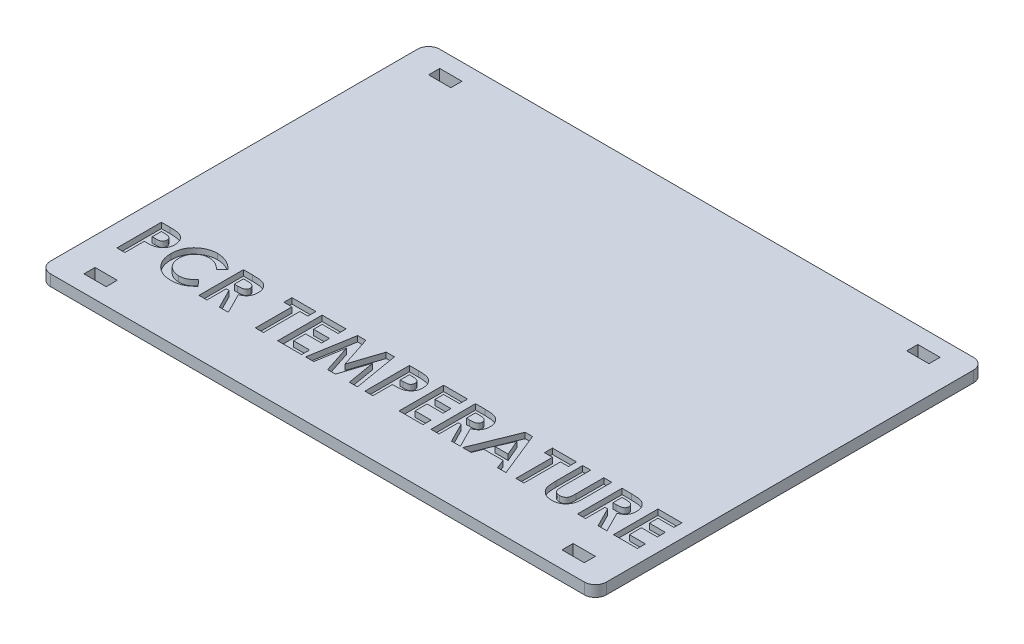
from build123d import *

# Parameters (mm, degrees)
BOSS_EXTRUDE1_DEPTH = 2
SKETCH4_W           = 92
SKETCH4_H           = 62
BOSS_EXTRUDE2_DEPTH = 2
SKETCH5_W           = 4
SKETCH5_H           = 2
CUT_EXTRUDE1_DEPTH  = 62.163714733
CUT_EXTRUDE2_DEPTH  = 1


with BuildPart() as part:
    # Sketch1 → Boss-Extrude1 (new body)
    with BuildSketch(Plane(origin=(0, 0, 0), x_dir=(1, 0, 0), z_dir=(0, 1, 0))):
        with BuildLine():
            Line((-48, 35), (48, 35))
            ThreePointArc((48, 35), (49.414213562, 34.414213562), (50, 33))
            Line((50, 33), (50, -33))
            ThreePointArc((50, -33), (49.414213562, -34.414213562), (48, -35))
            Line((48, -35), (-48, -35))
            ThreePointArc((-48, -35), (-49.414213562, -34.414213562), (-50, -33))
            Line((-50, -33), (-50, 33))
            ThreePointArc((-50, 33), (-49.414213562, 34.414213562), (-48, 35))
        make_face()
    extrude(amount=BOSS_EXTRUDE1_DEPTH)

    # Sketch4 → Boss-Extrude2 (add)
    with BuildSketch(Plane(origin=(0, 0, 0), x_dir=(-1, 0, 0), z_dir=(0, -1, 0))):
        with BuildLine():
            Line((46, 33), (-46, 33))
            ThreePointArc((-46, 33), (-47.414213562, 32.414213562), (-48, 31))
            Line((-48, 31), (-48, -31))
            ThreePointArc((-48, -31), (-47.414213562, -32.414213562), (-46, -33))
            Line((-46, -33), (46, -33))
            ThreePointArc((46, -33), (47.414213562, -32.414213562), (48, -31))
            Line((48, -31), (48, 31))
            ThreePointArc((48, 31), (47.414213562, 32.414213562), (46, 33))
        make_face()
        Rectangle(SKETCH4_W, SKETCH4_H, mode=Mode.SUBTRACT)
    extrude(amount=BOSS_EXTRUDE2_DEPTH)

    # Sketch5 → Cut-Extrude1 (cut, through all)
    with BuildSketch(Plane(origin=(0, 2, 0), x_dir=(1, 0, 0), z_dir=(0, 1, 0))):
        with Locations((-43, 31)):
            Rectangle(SKETCH5_W, SKETCH5_H)
        with Locations((43, 31)):
            Rectangle(SKETCH5_W, SKETCH5_H)
        with Locations((43, -31)):
            Rectangle(SKETCH5_W, SKETCH5_H)
        with Locations((-43, -31)):
            Rectangle(SKETCH5_W, SKETCH5_H)
    extrude(amount=-CUT_EXTRUDE1_DEPTH, mode=Mode.SUBTRACT)

    # Sketch6 → Cut-Extrude2 (cut)
    # profile 1 of 14: a face of its own
    with BuildSketch(Plane(origin=(0, 2, 0), x_dir=(1, 0, 0), z_dir=(0, 1, 0))):
        with BuildLine():
            Line((-46.076923077, -17), (-44.474358974, -17))
            add(Edge.make_bspline(
                [(-44.474358974, -17), (-44.369649515, -17.000468702), (-44.167643019, -17.001372926), (-43.876333032, -17.012337846), (-43.607585306, -17.031987649), (-43.361461585, -17.0562717), (-43.138063069, -17.090316993), (-42.937109996, -17.129347256), (-42.758560663, -17.176897476), (-42.600401662, -17.233338929), (-42.458459067, -17.299881196), (-42.324135592, -17.37075346), (-42.200466961, -17.455337008), (-42.081211246, -17.544515784), (-41.973186501, -17.646809002), (-41.869653496, -17.7554089), (-41.774997136, -17.874622461), (-41.688778819, -18.003006636), (-41.61056552, -18.138189435), (-41.54223315, -18.280412526), (-41.486805758, -18.42990096), (-41.440309068, -18.585687718), (-41.402962474, -18.74776601), (-41.378103392, -18.917132632), (-41.361217853, -19.092605002), (-41.359727937, -19.212031608), (-41.358974359, -19.272435897)],
                knots=[0, 0, 0, 0, 1.698747864, 3.27724071, 4.728299578, 6.070144658, 7.288476769, 8.393259625, 9.389771311, 10.283485332, 11.113357557, 11.931608583, 12.74405601, 13.541433047, 14.344816069, 15.154114104, 15.974336324, 16.810834471, 17.661136416, 18.50621059, 19.367396281, 20.244825668, 21.142564693, 22.063065223, 23.020325768, 24, 24, 24, 24], degree=3))
            add(Edge.make_bspline(
                [(-41.358974359, -19.272435897), (-41.360064692, -19.339259724), (-41.362207332, -19.470576756), (-41.3832121, -19.663071413), (-41.419094882, -19.846597641), (-41.4659918, -20.022703149), (-41.531386217, -20.18849061), (-41.606096269, -20.347915765), (-41.698013329, -20.496508821), (-41.803043264, -20.636128499), (-41.917747936, -20.767909972), (-42.044850429, -20.888048301), (-42.181928113, -20.997362462), (-42.328187497, -21.096998079), (-42.48417768, -21.186754162), (-42.649786109, -21.267471184), (-42.826143652, -21.336567562), (-42.948953738, -21.372704408), (-43.011217949, -21.391025641)],
                knots=[0, 0, 0, 0, 1.102006807, 2.165578795, 3.188629044, 4.184801286, 5.166646146, 6.124351954, 7.085497154, 8.042432466, 9.003981491, 9.963833307, 10.922997304, 11.89326795, 12.880200226, 13.889073926, 14.929769137, 16, 16, 16, 16], degree=3))
            add(Edge.make_bspline(
                [(-43.011217949, -21.391025641), (-43.052228739, -21.401229192), (-43.141071318, -21.42333337), (-43.288081384, -21.445774658), (-43.45749505, -21.466408042), (-43.649860141, -21.484139938), (-43.865287559, -21.496193496), (-44.103568716, -21.505606788), (-44.364811596, -21.512451224), (-44.546469564, -21.512694095), (-44.641025641, -21.512820513)],
                knots=[0, 0, 0, 0, 0.618981996, 1.340914327, 2.176866532, 3.120127938, 4.170906482, 5.338178032, 6.614476169, 8, 8, 8, 8], degree=3))
            Line((-44.641025641, -21.512820513), (-44.641025641, -25))
            Line((-44.641025641, -25), (-46.076923077, -25))
            Line((-46.076923077, -25), (-46.076923077, -17))
        make_face()
        with BuildLine():
            Line((-44.641025641, -20.076923077), (-44.133012821, -20.076923077))
            add(Edge.make_bspline(
                [(-44.133012821, -20.076923077), (-44.040571867, -20.07633693), (-43.870479141, -20.07525841), (-43.638192541, -20.059662385), (-43.451522561, -20.035844105), (-43.304049811, -20.001683183), (-43.187606106, -19.94983946), (-43.087180701, -19.889866036), (-43.001043267, -19.814031287), (-42.926460928, -19.727377111), (-42.866834595, -19.62780712), (-42.825486839, -19.516942617), (-42.79862815, -19.397112984), (-42.7961475, -19.313719492), (-42.794871795, -19.270833333)],
                knots=[0, 0, 0, 0, 1.8619151, 3.425951444, 4.686033666, 5.651700536, 6.461346321, 7.243864085, 7.999046032, 8.762387399, 9.539336099, 10.322741239, 11.137448474, 12, 12, 12, 12], degree=3))
            add(Edge.make_bspline(
                [(-42.794871795, -19.270833333), (-42.796134378, -19.233364255), (-42.798584092, -19.160665236), (-42.816580362, -19.055742518), (-42.845261239, -18.9579329), (-42.886818728, -18.868257874), (-42.940542721, -18.786869813), (-43.00604314, -18.713800778), (-43.082479486, -18.647485934), (-43.141492814, -18.612384474), (-43.171474359, -18.594551282)],
                knots=[0, 0, 0, 0, 1.102301479, 2.1387299, 3.123554645, 4.094223062, 5.036071848, 5.982632524, 6.975082478, 8, 8, 8, 8], degree=3))
            add(Edge.make_bspline(
                [(-43.171474359, -18.594551282), (-43.196870458, -18.581707746), (-43.250639205, -18.554515349), (-43.342212594, -18.5229022), (-43.447886886, -18.496233025), (-43.568375502, -18.474097868), (-43.703197778, -18.456918687), (-43.85232966, -18.443780912), (-44.01599061, -18.4384977), (-44.129807007, -18.436788097), (-44.189102564, -18.435897436)],
                knots=[0, 0, 0, 0, 0.656809284, 1.390599849, 2.23162475, 3.173112763, 4.218524733, 5.370385145, 6.63003504, 8, 8, 8, 8], degree=3))
            Line((-44.189102564, -18.435897436), (-44.641025641, -18.435897436))
            Line((-44.641025641, -18.435897436), (-44.641025641, -20.076923077))
        make_face(mode=Mode.SUBTRACT)
    # profile 2 of 14: a face of its own
    with BuildSketch(Plane(origin=(0, 2, 0), x_dir=(1, 0, 0), z_dir=(0, 1, 0))):
        with BuildLine():
            Line((-32.743589744, -18.387820513), (-33.796474359, -19.394230769))
            add(Edge.make_bspline(
                [(-33.796474359, -19.394230769), (-33.88578861, -19.301879684), (-34.060247323, -19.121489083), (-34.341365963, -18.882667824), (-34.633719112, -18.683642618), (-34.931619625, -18.516024857), (-35.240425868, -18.389210074), (-35.556567199, -18.296798006), (-35.882062274, -18.240457861), (-36.102344821, -18.234011551), (-36.213141026, -18.230769231)],
                knots=[0, 0, 0, 0, 1.115251505, 2.178435587, 3.19620269, 4.182487026, 5.141301733, 6.088180966, 7.038406374, 8, 8, 8, 8], degree=3))
            add(Edge.make_bspline(
                [(-36.213141026, -18.230769231), (-36.305669321, -18.233330777), (-36.488263717, -18.238385707), (-36.75636014, -18.275443331), (-37.012808224, -18.338461432), (-37.258485831, -18.425312048), (-37.492670045, -18.537692136), (-37.715851862, -18.675514717), (-37.927481037, -18.837535056), (-38.12476207, -19.022914853), (-38.305227826, -19.225456212), (-38.464680812, -19.441567358), (-38.598248266, -19.670753194), (-38.707864902, -19.910692693), (-38.793252025, -20.162496415), (-38.854229158, -20.425994835), (-38.889496702, -20.70150176), (-38.89476062, -20.888789314), (-38.897435897, -20.983974359)],
                knots=[0, 0, 0, 0, 1.035432265, 2.043311493, 3.022114605, 3.98653278, 4.95457646, 5.923598177, 6.917315552, 7.932509744, 8.948865224, 9.949768934, 10.933144597, 11.912367597, 12.897413939, 13.903909035, 14.934704909, 16, 16, 16, 16], degree=3))
            add(Edge.make_bspline(
                [(-38.897435897, -20.983974359), (-38.896664913, -21.050781883), (-38.895145287, -21.182460886), (-38.878510289, -21.377250678), (-38.851724021, -21.566242826), (-38.812957655, -21.749151058), (-38.764479932, -21.926133885), (-38.707604526, -22.098718127), (-38.636255164, -22.264519059), (-38.557056297, -22.425462351), (-38.464948927, -22.577156464), (-38.365640191, -22.721809391), (-38.25795608, -22.858712057), (-38.141199118, -22.987304799), (-38.013726097, -23.105578002), (-37.878831722, -23.21708828), (-37.734240512, -23.319044155), (-37.582955992, -23.414004321), (-37.423671256, -23.496497025), (-37.260708068, -23.571219477), (-37.091595577, -23.631905219), (-36.91839283, -23.680823462), (-36.741718792, -23.722421123), (-36.559845427, -23.74803408), (-36.374349349, -23.767430474), (-36.248985136, -23.768628088), (-36.185897436, -23.769230769)],
                knots=[0, 0, 0, 0, 1.103660481, 2.175337485, 3.227646561, 4.255952547, 5.262355991, 6.258840057, 7.255597736, 8.242457506, 9.22035537, 10.185017736, 11.140346927, 12.096287581, 13.051739095, 14.01125915, 14.986044842, 15.97314143, 16.960198552, 17.947847494, 18.933482797, 19.925264591, 20.920966487, 21.929612487, 22.958107872, 24, 24, 24, 24], degree=3))
            add(Edge.make_bspline(
                [(-36.185897436, -23.769230769), (-36.078889854, -23.766135542), (-35.868647783, -23.760054226), (-35.560087313, -23.712499193), (-35.266059925, -23.634273854), (-35.031133449, -23.541894275), (-34.84707476, -23.450668241), (-34.706953601, -23.366288652), (-34.562057402, -23.271900817), (-34.414792765, -23.163942438), (-34.263503254, -23.043709057), (-34.110859478, -22.908567341), (-33.95295373, -22.762967311), (-33.849511239, -22.659049709), (-33.796474359, -22.605769231)],
                knots=[0, 0, 0, 0, 1.404581149, 2.759636711, 4.088442092, 5.392261763, 6.066678138, 6.783632037, 7.538459478, 8.336747902, 9.180226004, 10.074962426, 11.012997595, 12, 12, 12, 12], degree=3))
            Line((-33.796474359, -22.605769231), (-32.775641026, -23.677884615))
            add(Edge.make_bspline(
                [(-32.775641026, -23.677884615), (-32.847400114, -23.747165763), (-32.987458509, -23.882387746), (-33.198732709, -24.074390344), (-33.409741013, -24.246926022), (-33.615385898, -24.40625707), (-33.819036044, -24.547741786), (-34.020669852, -24.671521474), (-34.21800474, -24.780726701), (-34.415138431, -24.873515774), (-34.613297591, -24.952303334), (-34.817180081, -25.020134252), (-35.027409187, -25.077516768), (-35.245268893, -25.123816923), (-35.468727137, -25.160943396), (-35.699875191, -25.186003551), (-35.937247461, -25.202850659), (-36.09826075, -25.204364512), (-36.179487179, -25.205128205)],
                knots=[0, 0, 0, 0, 1.244526981, 2.429050516, 3.560637417, 4.644440555, 5.67424972, 6.652764056, 7.595344123, 8.486817594, 9.369275933, 10.254498637, 11.166417451, 12.086725134, 13.032340136, 13.991389299, 14.986715468, 16, 16, 16, 16], degree=3))
            add(Edge.make_bspline(
                [(-36.179487179, -25.205128205), (-36.328690069, -25.201324726), (-36.620638649, -25.193882374), (-37.048481681, -25.138739588), (-37.454921077, -25.046293679), (-37.840945628, -24.915549665), (-38.206432586, -24.748530314), (-38.55128845, -24.543772432), (-38.874957387, -24.301820029), (-39.174824791, -24.025509022), (-39.446069128, -23.720346711), (-39.685817711, -23.392686107), (-39.884137748, -23.040916878), (-40.048807148, -22.67023578), (-40.177576453, -22.278951251), (-40.268208214, -21.86664004), (-40.32410016, -21.433700259), (-40.330214818, -21.137992409), (-40.333333333, -20.987179487)],
                knots=[0, 0, 0, 0, 1.078019885, 2.10938526, 3.111377082, 4.085535484, 5.04941344, 6.010039228, 6.978205633, 7.964457913, 8.951525778, 9.924444315, 10.892603023, 11.863865945, 12.85144698, 13.863884204, 14.910567087, 16, 16, 16, 16], degree=3))
            add(Edge.make_bspline(
                [(-40.333333333, -20.987179487), (-40.3320156, -20.888820586), (-40.329404174, -20.693897284), (-40.301957849, -20.406759468), (-40.263696075, -20.126851458), (-40.202997251, -19.857079628), (-40.129830804, -19.593809653), (-40.038838715, -19.33990297), (-39.93016631, -19.094629825), (-39.807316357, -18.857579618), (-39.668337435, -18.63030528), (-39.513082721, -18.414759457), (-39.345549078, -18.209278175), (-39.161710945, -18.016587523), (-38.964239731, -17.834995641), (-38.752243877, -17.66548661), (-38.526998431, -17.505629479), (-38.287893738, -17.359546576), (-38.039574965, -17.227406825), (-37.785174065, -17.110853921), (-37.525316071, -17.013442534), (-37.261099687, -16.932643381), (-36.991408602, -16.872332527), (-36.718167802, -16.826679156), (-36.439052336, -16.80115863), (-36.251650481, -16.796980757), (-36.157051282, -16.794871795)],
                knots=[0, 0, 0, 0, 1.071919942, 2.124283339, 3.142214191, 4.149696895, 5.136002878, 6.119640489, 7.086990633, 8.058538607, 9.028339693, 9.988281803, 10.952401235, 11.916291999, 12.888973767, 13.874849856, 14.873389453, 15.898127285, 16.927174885, 17.938320013, 18.946391617, 19.950418109, 20.947802303, 21.956882652, 22.968648068, 24, 24, 24, 24], degree=3))
            add(Edge.make_bspline(
                [(-36.157051282, -16.794871795), (-36.076348466, -16.796080705), (-35.915781917, -16.798485955), (-35.676671382, -16.818536333), (-35.439473142, -16.850025249), (-35.205036438, -16.897535318), (-34.971684339, -16.953935774), (-34.742483354, -17.02778439), (-34.513817714, -17.11010259), (-34.289273698, -17.20849719), (-34.068537878, -17.315903784), (-33.856781336, -17.437760465), (-33.650448701, -17.566568309), (-33.454112179, -17.709950729), (-33.264093964, -17.862706978), (-33.081387679, -18.02554975), (-32.907596679, -18.201194111), (-32.798535096, -18.325297221), (-32.743589744, -18.387820513)],
                knots=[0, 0, 0, 0, 0.996412454, 1.982464992, 2.961075852, 3.949442424, 4.934965278, 5.923860011, 6.921385422, 7.934793307, 8.949617135, 9.951082467, 10.950285876, 11.951772932, 12.951063433, 13.960125323, 14.972308753, 16, 16, 16, 16], degree=3))
        make_face()
    # profile 3 of 14: a face of its own
    with BuildSketch(Plane(origin=(0, 2, 0), x_dir=(1, 0, 0), z_dir=(0, 1, 0))):
        with BuildLine():
            Line((-31.307692308, -17), (-29.634615385, -17))
            add(Edge.make_bspline(
                [(-29.634615385, -17), (-29.524025509, -17.000392531), (-29.311330027, -17.001147477), (-29.00463476, -17.01305854), (-28.722892979, -17.02963376), (-28.465687541, -17.054927987), (-28.233128483, -17.088465074), (-28.024982725, -17.12799975), (-27.841256351, -17.173057989), (-27.680399885, -17.229204111), (-27.535234878, -17.292536084), (-27.39992091, -17.365305683), (-27.271472753, -17.446702594), (-27.150748944, -17.538868592), (-27.036700366, -17.640145632), (-26.929111858, -17.750635659), (-26.829503747, -17.871275584), (-26.738492809, -18.001303116), (-26.655543665, -18.138089097), (-26.582234019, -18.281821336), (-26.522618493, -18.432599789), (-26.469941786, -18.588245382), (-26.43200046, -18.750983099), (-26.405612823, -18.91922866), (-26.386292827, -19.093574309), (-26.385182019, -19.212017001), (-26.384615385, -19.272435897)],
                knots=[0, 0, 0, 0, 1.749336639, 3.364467119, 4.854658419, 6.213483162, 7.451590619, 8.570285859, 9.5643256, 10.440900261, 11.26203566, 12.067320669, 12.869050712, 13.665104639, 14.467235401, 15.27997916, 16.102287765, 16.939272006, 17.78853747, 18.631303466, 19.488103222, 20.351255419, 21.228522269, 22.127379805, 23.044756219, 24, 24, 24, 24], degree=3))
            add(Edge.make_bspline(
                [(-26.384615385, -19.272435897), (-26.386087298, -19.335499346), (-26.388973452, -19.459155274), (-26.404519849, -19.640795747), (-26.432933779, -19.814576646), (-26.475970808, -19.979989163), (-26.525436284, -20.139092048), (-26.591212678, -20.288949755), (-26.66544784, -20.431741746), (-26.753614773, -20.565448174), (-26.850373675, -20.693038928), (-26.962902243, -20.80962553), (-27.083910353, -20.92147407), (-27.220200313, -21.021578735), (-27.365764334, -21.116708241), (-27.52349462, -21.202920907), (-27.692361771, -21.282383921), (-27.81108374, -21.326697987), (-27.871794872, -21.349358974)],
                knots=[0, 0, 0, 0, 1.099860209, 2.156625411, 3.176576793, 4.16617041, 5.135385252, 6.078461593, 7.016046972, 7.938469504, 8.868247731, 9.803980173, 10.76021508, 11.73834243, 12.748633912, 13.790971185, 14.870363756, 16, 16, 16, 16], degree=3))
            Line((-27.871794872, -21.349358974), (-26.025641026, -25))
            Line((-26.025641026, -25), (-27.621794872, -25))
            Line((-27.621794872, -25), (-29.384615385, -21.512820513))
            Line((-29.384615385, -21.512820513), (-29.871794872, -21.512820513))
            Line((-29.871794872, -21.512820513), (-29.871794872, -25))
            Line((-29.871794872, -25), (-31.307692308, -25))
            Line((-31.307692308, -25), (-31.307692308, -17))
        make_face()
        with BuildLine():
            Line((-29.871794872, -20.076923077), (-29.3125, -20.076923077))
            add(Edge.make_bspline(
                [(-29.3125, -20.076923077), (-29.244121553, -20.076152953), (-29.113191519, -20.074678331), (-28.924896934, -20.067838423), (-28.753880545, -20.051357624), (-28.59940795, -20.03053475), (-28.460701856, -20.006491735), (-28.338999474, -19.972036635), (-28.232425555, -19.935117124), (-28.142243005, -19.889235747), (-28.065193105, -19.837058672), (-27.998665449, -19.777784216), (-27.943637538, -19.709181582), (-27.898346761, -19.633115092), (-27.86311546, -19.548911957), (-27.83739931, -19.457496537), (-27.823027785, -19.357827493), (-27.821374292, -19.289042281), (-27.820512821, -19.253205128)],
                knots=[0, 0, 0, 0, 1.688639943, 3.233382647, 4.650958383, 5.928841754, 7.082724185, 8.122798841, 9.049171256, 9.863274652, 10.613301712, 11.341792392, 12.054588806, 12.776240173, 13.521029143, 14.301969904, 15.115324896, 16, 16, 16, 16], degree=3))
            add(Edge.make_bspline(
                [(-27.820512821, -19.253205128), (-27.822141511, -19.21080716), (-27.825340771, -19.127524208), (-27.857087371, -19.00762596), (-27.9076211, -18.896651928), (-27.976889003, -18.79510352), (-28.06412292, -18.706079176), (-28.164230723, -18.627603508), (-28.27937298, -18.565550821), (-28.385986045, -18.52462153), (-28.482979014, -18.500133112), (-28.570512108, -18.48188456), (-28.671875959, -18.468951288), (-28.787147089, -18.45523325), (-28.91603167, -18.446337797), (-29.059232199, -18.439845889), (-29.216337405, -18.437189731), (-29.325854655, -18.436340604), (-29.383012821, -18.435897436)],
                knots=[0, 0, 0, 0, 1.020303359, 2.004196876, 2.966617323, 3.9489082, 4.950758222, 5.960522915, 7.003732012, 8.091992268, 8.70421221, 9.413913587, 10.24622431, 11.166358409, 12.212345909, 13.359657661, 14.621978493, 16, 16, 16, 16], degree=3))
            Line((-29.383012821, -18.435897436), (-29.871794872, -18.435897436))
            Line((-29.871794872, -18.435897436), (-29.871794872, -20.076923077))
        make_face(mode=Mode.SUBTRACT)
    # profile 4 of 14: a face of its own
    with BuildSketch(Plane(origin=(0, 2, 0), x_dir=(1, 0, 0), z_dir=(0, 1, 0))):
        Polygon((-22.58974359, -17), (-18.282051282, -17), (-18.282051282, -18.435897436), (-19.717948718, -18.435897436), (-19.717948718, -25), (-21.153846154, -25), (-21.153846154, -18.435897436), (-22.58974359, -18.435897436), align=None)
    # profile 5 of 14: a face of its own
    with BuildSketch(Plane(origin=(0, 2, 0), x_dir=(1, 0, 0), z_dir=(0, 1, 0))):
        Polygon((-17.153846154, -17), (-12.846153846, -17), (-12.846153846, -18.435897436), (-15.717948718, -18.435897436), (-15.717948718, -19.974358974), (-12.846153846, -19.974358974), (-12.846153846, -21.41025641), (-15.717948718, -21.41025641), (-15.717948718, -23.564102564), (-12.846153846, -23.564102564), (-12.846153846, -25), (-17.153846154, -25), align=None)
    # profile 6 of 14: a face of its own
    with BuildSketch(Plane(origin=(0, 2, 0), x_dir=(1, 0, 0), z_dir=(0, 1, 0))):
        Polygon((-10.77724359, -17), (-9.290064103, -17), (-7.461538462, -22.580128205), (-5.623397436, -17), (-4.147435897, -17), (-2.794871795, -25), (-4.248397436, -25), (-5.102564103, -19.947115385), (-6.766025641, -25), (-8.165064103, -25), (-9.820512821, -19.947115385), (-10.673076923, -25), (-12.128205128, -25), align=None)
    # profile 7 of 14: a face of its own
    with BuildSketch(Plane(origin=(0, 2, 0), x_dir=(1, 0, 0), z_dir=(0, 1, 0))):
        with BuildLine():
            Line((-1.461538462, -17), (0.141025641, -17))
            add(Edge.make_bspline(
                [(0.141025641, -17), (0.245735101, -17.000468702), (0.447741596, -17.001372926), (0.739051583, -17.012337846), (1.007799309, -17.031987649), (1.25392303, -17.0562717), (1.477321546, -17.090316993), (1.678274619, -17.129347256), (1.856823952, -17.176897476), (2.014982953, -17.233338929), (2.156925548, -17.299881196), (2.291249024, -17.37075346), (2.414917654, -17.455337008), (2.53417337, -17.544515784), (2.642198115, -17.646809002), (2.74573112, -17.7554089), (2.840387479, -17.874622461), (2.926605796, -18.003006636), (3.004819095, -18.138189435), (3.073151465, -18.280412526), (3.128578857, -18.42990096), (3.175075547, -18.585687718), (3.212422141, -18.74776601), (3.237281223, -18.917132632), (3.254166762, -19.092605002), (3.255656678, -19.212031608), (3.256410256, -19.272435897)],
                knots=[0, 0, 0, 0, 1.698747864, 3.27724071, 4.728299578, 6.070144658, 7.288476769, 8.393259625, 9.389771311, 10.283485332, 11.113357557, 11.931608583, 12.74405601, 13.541433047, 14.344816069, 15.154114104, 15.974336324, 16.810834471, 17.661136416, 18.50621059, 19.367396281, 20.244825668, 21.142564693, 22.063065223, 23.020325768, 24, 24, 24, 24], degree=3))
            add(Edge.make_bspline(
                [(3.256410256, -19.272435897), (3.255319923, -19.339259724), (3.253177284, -19.470576756), (3.232172515, -19.663071413), (3.196289734, -19.846597641), (3.149392815, -20.022703149), (3.083998398, -20.18849061), (3.009288347, -20.347915765), (2.917371287, -20.496508821), (2.812341351, -20.636128499), (2.697636679, -20.767909972), (2.570534187, -20.888048301), (2.433456502, -20.997362462), (2.287197119, -21.096998079), (2.131206935, -21.186754162), (1.965598507, -21.267471184), (1.789240964, -21.336567562), (1.666430877, -21.372704408), (1.604166667, -21.391025641)],
                knots=[0, 0, 0, 0, 1.102006807, 2.165578795, 3.188629044, 4.184801286, 5.166646146, 6.124351954, 7.085497154, 8.042432466, 9.003981491, 9.963833307, 10.922997304, 11.89326795, 12.880200226, 13.889073926, 14.929769137, 16, 16, 16, 16], degree=3))
            add(Edge.make_bspline(
                [(1.604166667, -21.391025641), (1.563155876, -21.401229192), (1.474313297, -21.42333337), (1.327303231, -21.445774658), (1.157889565, -21.466408042), (0.965524475, -21.484139938), (0.750097056, -21.496193496), (0.511815899, -21.505606788), (0.25057302, -21.512451224), (0.068915052, -21.512694095), (-0.025641026, -21.512820513)],
                knots=[0, 0, 0, 0, 0.618981996, 1.340914327, 2.176866532, 3.120127938, 4.170906482, 5.338178032, 6.614476169, 8, 8, 8, 8], degree=3))
            Line((-0.025641026, -21.512820513), (-0.025641026, -25))
            Line((-0.025641026, -25), (-1.461538462, -25))
            Line((-1.461538462, -25), (-1.461538462, -17))
        make_face()
        with BuildLine():
            Line((-0.025641026, -20.076923077), (0.482371795, -20.076923077))
            add(Edge.make_bspline(
                [(0.482371795, -20.076923077), (0.574812748, -20.07633693), (0.744905475, -20.07525841), (0.977192075, -20.059662385), (1.163862054, -20.035844105), (1.311334805, -20.001683183), (1.427778509, -19.94983946), (1.528203914, -19.889866036), (1.614341348, -19.814031287), (1.688923688, -19.727377111), (1.74855002, -19.62780712), (1.789897776, -19.516942617), (1.816756466, -19.397112984), (1.819237115, -19.313719492), (1.820512821, -19.270833333)],
                knots=[0, 0, 0, 0, 1.8619151, 3.425951444, 4.686033666, 5.651700536, 6.461346321, 7.243864085, 7.999046032, 8.762387399, 9.539336099, 10.322741239, 11.137448474, 12, 12, 12, 12], degree=3))
            add(Edge.make_bspline(
                [(1.820512821, -19.270833333), (1.819250238, -19.233364255), (1.816800523, -19.160665236), (1.798804253, -19.055742518), (1.770123376, -18.9579329), (1.728565887, -18.868257874), (1.674841895, -18.786869813), (1.609341476, -18.713800778), (1.53290513, -18.647485934), (1.473891802, -18.612384474), (1.443910256, -18.594551282)],
                knots=[0, 0, 0, 0, 1.102301479, 2.1387299, 3.123554645, 4.094223062, 5.036071848, 5.982632524, 6.975082478, 8, 8, 8, 8], degree=3))
            add(Edge.make_bspline(
                [(1.443910256, -18.594551282), (1.418514157, -18.581707746), (1.36474541, -18.554515349), (1.273172022, -18.5229022), (1.16749773, -18.496233025), (1.047009114, -18.474097868), (0.912186838, -18.456918687), (0.763054955, -18.443780912), (0.599394006, -18.4384977), (0.485577608, -18.436788097), (0.426282051, -18.435897436)],
                knots=[0, 0, 0, 0, 0.656809284, 1.390599849, 2.23162475, 3.173112763, 4.218524733, 5.370385145, 6.63003504, 8, 8, 8, 8], degree=3))
            Line((0.426282051, -18.435897436), (-0.025641026, -18.435897436))
            Line((-0.025641026, -18.435897436), (-0.025641026, -20.076923077))
        make_face(mode=Mode.SUBTRACT)
    # profile 8 of 14: a face of its own
    with BuildSketch(Plane(origin=(0, 2, 0), x_dir=(1, 0, 0), z_dir=(0, 1, 0))):
        Polygon((4.692307692, -17), (9, -17), (9, -18.435897436), (6.128205128, -18.435897436), (6.128205128, -19.974358974), (9, -19.974358974), (9, -21.41025641), (6.128205128, -21.41025641), (6.128205128, -23.564102564), (9, -23.564102564), (9, -25), (4.692307692, -25), align=None)
    # profile 9 of 14: a face of its own
    with BuildSketch(Plane(origin=(0, 2, 0), x_dir=(1, 0, 0), z_dir=(0, 1, 0))):
        with BuildLine():
            Line((10.435897436, -17), (12.108974359, -17))
            add(Edge.make_bspline(
                [(12.108974359, -17), (12.219564234, -17.000392531), (12.432259716, -17.001147477), (12.738954984, -17.01305854), (13.020696764, -17.02963376), (13.277902202, -17.054927987), (13.510461261, -17.088465074), (13.718607019, -17.12799975), (13.902333392, -17.173057989), (14.063189859, -17.229204111), (14.208354866, -17.292536084), (14.343668834, -17.365305683), (14.472116991, -17.446702594), (14.5928408, -17.538868592), (14.706889378, -17.640145632), (14.814477885, -17.750635659), (14.914085997, -17.871275584), (15.005096935, -18.001303116), (15.088046078, -18.138089097), (15.161355724, -18.281821336), (15.22097125, -18.432599789), (15.273647958, -18.588245382), (15.311589284, -18.750983099), (15.337976921, -18.91922866), (15.357296917, -19.093574309), (15.358407724, -19.212017001), (15.358974359, -19.272435897)],
                knots=[0, 0, 0, 0, 1.749336639, 3.364467119, 4.854658419, 6.213483162, 7.451590619, 8.570285859, 9.5643256, 10.440900261, 11.26203566, 12.067320669, 12.869050712, 13.665104639, 14.467235401, 15.27997916, 16.102287765, 16.939272006, 17.78853747, 18.631303466, 19.488103222, 20.351255419, 21.228522269, 22.127379805, 23.044756219, 24, 24, 24, 24], degree=3))
            add(Edge.make_bspline(
                [(15.358974359, -19.272435897), (15.357502445, -19.335499346), (15.354616291, -19.459155274), (15.339069895, -19.640795747), (15.310655965, -19.814576646), (15.267618935, -19.979989163), (15.218153459, -20.139092048), (15.152377065, -20.288949755), (15.078141903, -20.431741746), (14.98997497, -20.565448174), (14.893216068, -20.693038928), (14.780687501, -20.80962553), (14.659679391, -20.92147407), (14.523389431, -21.021578735), (14.37782541, -21.116708241), (14.220095123, -21.202920907), (14.051227973, -21.282383921), (13.932506004, -21.326697987), (13.871794872, -21.349358974)],
                knots=[0, 0, 0, 0, 1.099860209, 2.156625411, 3.176576793, 4.16617041, 5.135385252, 6.078461593, 7.016046972, 7.938469504, 8.868247731, 9.803980173, 10.76021508, 11.73834243, 12.748633912, 13.790971185, 14.870363756, 16, 16, 16, 16], degree=3))
            Line((13.871794872, -21.349358974), (15.717948718, -25))
            Line((15.717948718, -25), (14.121794872, -25))
            Line((14.121794872, -25), (12.358974359, -21.512820513))
            Line((12.358974359, -21.512820513), (11.871794872, -21.512820513))
            Line((11.871794872, -21.512820513), (11.871794872, -25))
            Line((11.871794872, -25), (10.435897436, -25))
            Line((10.435897436, -25), (10.435897436, -17))
        make_face()
        with BuildLine():
            Line((11.871794872, -20.076923077), (12.431089744, -20.076923077))
            add(Edge.make_bspline(
                [(12.431089744, -20.076923077), (12.499468191, -20.076152953), (12.630398225, -20.074678331), (12.81869281, -20.067838423), (12.989709199, -20.051357624), (13.144181794, -20.03053475), (13.282887887, -20.006491735), (13.404590269, -19.972036635), (13.511164188, -19.935117124), (13.601346739, -19.889235747), (13.678396638, -19.837058672), (13.744924294, -19.777784216), (13.799952205, -19.709181582), (13.845242983, -19.633115092), (13.880474283, -19.548911957), (13.906190434, -19.457496537), (13.920561959, -19.357827493), (13.922215452, -19.289042281), (13.923076923, -19.253205128)],
                knots=[0, 0, 0, 0, 1.688639943, 3.233382647, 4.650958383, 5.928841754, 7.082724185, 8.122798841, 9.049171256, 9.863274652, 10.613301712, 11.341792392, 12.054588806, 12.776240173, 13.521029143, 14.301969904, 15.115324896, 16, 16, 16, 16], degree=3))
            add(Edge.make_bspline(
                [(13.923076923, -19.253205128), (13.921448233, -19.21080716), (13.918248973, -19.127524208), (13.886502373, -19.00762596), (13.835968643, -18.896651928), (13.766700741, -18.79510352), (13.679466823, -18.706079176), (13.57935902, -18.627603508), (13.464216764, -18.565550821), (13.357603699, -18.52462153), (13.26061073, -18.500133112), (13.173077635, -18.48188456), (13.071713785, -18.468951288), (12.956442654, -18.45523325), (12.827558074, -18.446337797), (12.684357545, -18.439845889), (12.527252339, -18.437189731), (12.417735089, -18.436340604), (12.360576923, -18.435897436)],
                knots=[0, 0, 0, 0, 1.020303359, 2.004196876, 2.966617323, 3.9489082, 4.950758222, 5.960522915, 7.003732012, 8.091992268, 8.70421221, 9.413913587, 10.24622431, 11.166358409, 12.212345909, 13.359657661, 14.621978493, 16, 16, 16, 16], degree=3))
            Line((12.360576923, -18.435897436), (11.871794872, -18.435897436))
            Line((11.871794872, -18.435897436), (11.871794872, -20.076923077))
        make_face(mode=Mode.SUBTRACT)
    # profile 10 of 14: a face of its own
    with BuildSketch(Plane(origin=(0, 2, 0), x_dir=(1, 0, 0), z_dir=(0, 1, 0))):
        Polygon((19.357371795, -17), (20.692307692, -17), (23.923076923, -25), (22.389423077, -25), (21.767628205, -23.358974359), (18.28525641, -23.358974359), (17.661858974, -25), (16.128205128, -25), align=None)
        Polygon((20.025641026, -19.145833333), (18.830128205, -21.923076923), (21.22275641, -21.923076923), align=None, mode=Mode.SUBTRACT)
    # profile 11 of 14: a face of its own
    with BuildSketch(Plane(origin=(0, 2, 0), x_dir=(1, 0, 0), z_dir=(0, 1, 0))):
        Polygon((24.282051282, -17), (28.58974359, -17), (28.58974359, -18.435897436), (27.153846154, -18.435897436), (27.153846154, -25), (25.717948718, -25), (25.717948718, -18.435897436), (24.282051282, -18.435897436), align=None)
    # profile 12 of 14: a face of its own
    with BuildSketch(Plane(origin=(0, 2, 0), x_dir=(1, 0, 0), z_dir=(0, 1, 0))):
        with BuildLine():
            Line((29.717948718, -17), (31.153846154, -17))
            Line((31.153846154, -17), (31.153846154, -22.205128205))
            add(Edge.make_bspline(
                [(31.153846154, -22.205128205), (31.153924231, -22.259092717), (31.154075036, -22.363324613), (31.161624411, -22.512863259), (31.168532609, -22.650320585), (31.18099696, -22.775546103), (31.199411079, -22.888593383), (31.217241954, -22.990188598), (31.241374281, -23.078512802), (31.27764131, -23.179048869), (31.333516896, -23.292006633), (31.424814504, -23.409733805), (31.530164132, -23.517176937), (31.65643173, -23.606608529), (31.798345343, -23.678950627), (31.95512522, -23.732548115), (32.126550356, -23.762341202), (32.245081434, -23.766889663), (32.306089744, -23.769230769)],
                knots=[0, 0, 0, 0, 1.155499968, 2.231836252, 3.205919964, 4.102923608, 4.924856345, 5.658536265, 6.31071849, 6.882491295, 7.94666036, 8.992281882, 10.060072772, 11.158554251, 12.289267114, 13.461410017, 14.693379945, 16, 16, 16, 16], degree=3))
            add(Edge.make_bspline(
                [(32.306089744, -23.769230769), (32.370903544, -23.767339456), (32.497279481, -23.763651714), (32.679051148, -23.727452542), (32.847463628, -23.669811062), (32.998951055, -23.58754198), (33.133362675, -23.488928067), (33.247139294, -23.376477303), (33.336931384, -23.249965406), (33.395454528, -23.133248547), (33.428312391, -23.025820843), (33.452940996, -22.929838265), (33.470996488, -22.816588324), (33.487377024, -22.687839662), (33.497220464, -22.542258691), (33.507894071, -22.381016192), (33.511806046, -22.2030089), (33.512472814, -22.079059082), (33.512820513, -22.014423077)],
                knots=[0, 0, 0, 0, 1.261321664, 2.459363699, 3.594844139, 4.716940403, 5.803436589, 6.833651888, 7.818396249, 8.814403945, 9.360733334, 10.004355033, 10.743453831, 11.592799886, 12.532235708, 13.585170094, 14.740740724, 16, 16, 16, 16], degree=3))
            Line((33.512820513, -22.014423077), (33.512820513, -17))
            Line((33.512820513, -17), (34.948717949, -17))
            Line((34.948717949, -17), (34.948717949, -21.772435897))
            add(Edge.make_bspline(
                [(34.948717949, -21.772435897), (34.948518548, -21.869125221), (34.948135121, -22.055049359), (34.942246828, -22.322235431), (34.929711719, -22.566267048), (34.919183672, -22.787215517), (34.898808298, -22.984783184), (34.877581937, -23.159813719), (34.850527114, -23.311686853), (34.810271165, -23.484575959), (34.740801313, -23.683651434), (34.628806805, -23.912878213), (34.486637026, -24.137305114), (34.318599452, -24.354463288), (34.12886966, -24.556196233), (33.921654366, -24.733291646), (33.700245706, -24.883095269), (33.462330117, -25.001944223), (33.208110079, -25.094637447), (32.935070273, -25.156922625), (32.643396891, -25.199003273), (32.441932573, -25.203045637), (32.338141026, -25.205128205)],
                knots=[0, 0, 0, 0, 1.170808336, 2.251350247, 3.235597562, 4.129743112, 4.929140599, 5.639994148, 6.264258765, 6.79612947, 7.788252245, 8.809469599, 9.879094798, 10.999557536, 12.129761673, 13.226370002, 14.293821979, 15.358369427, 16.438775801, 17.562147481, 18.744053101, 20, 20, 20, 20], degree=3))
            add(Edge.make_bspline(
                [(32.338141026, -25.205128205), (32.269179857, -25.203966645), (32.133120885, -25.201674912), (31.933022299, -25.181467807), (31.739587708, -25.151690133), (31.553180575, -25.108247572), (31.373153915, -25.052127898), (31.199555558, -24.983048488), (31.033030637, -24.901394657), (30.874511002, -24.807917445), (30.724191725, -24.706837932), (30.586807665, -24.594787036), (30.457631114, -24.480051346), (30.340393929, -24.357802294), (30.234215554, -24.22932329), (30.139314664, -24.094323156), (30.05583225, -23.952813884), (29.981668357, -23.802244778), (29.918191303, -23.634962953), (29.864677762, -23.445018127), (29.817927073, -23.229433104), (29.78318472, -22.987722181), (29.751687098, -22.720682012), (29.731750841, -22.427616917), (29.721321287, -22.108518485), (29.719101314, -21.887294158), (29.717948718, -21.772435897)],
                knots=[0, 0, 0, 0, 1.001158378, 1.975264943, 2.917723546, 3.841610987, 4.75185031, 5.653588123, 6.552117133, 7.442167995, 8.324307438, 9.179605724, 10.014504199, 10.831958861, 11.636465792, 12.43274043, 13.225645099, 14.020104002, 14.867201867, 15.819789774, 16.883317127, 18.068162734, 19.364263498, 20.787406516, 22.332041935, 24, 24, 24, 24], degree=3))
            Line((29.717948718, -21.772435897), (29.717948718, -17))
        make_face()
    # profile 13 of 14: a face of its own
    with BuildSketch(Plane(origin=(0, 2, 0), x_dir=(1, 0, 0), z_dir=(0, 1, 0))):
        with BuildLine():
            Line((36.794871795, -17), (38.467948718, -17))
            add(Edge.make_bspline(
                [(38.467948718, -17), (38.578538593, -17.000392531), (38.791234075, -17.001147477), (39.097929343, -17.01305854), (39.379671123, -17.02963376), (39.636876561, -17.054927987), (39.86943562, -17.088465074), (40.077581378, -17.12799975), (40.261307751, -17.173057989), (40.422164218, -17.229204111), (40.567329225, -17.292536084), (40.702643193, -17.365305683), (40.83109135, -17.446702594), (40.951815159, -17.538868592), (41.065863737, -17.640145632), (41.173452244, -17.750635659), (41.273060356, -17.871275584), (41.364071294, -18.001303116), (41.447020437, -18.138089097), (41.520330083, -18.281821336), (41.579945609, -18.432599789), (41.632622317, -18.588245382), (41.670563643, -18.750983099), (41.69695128, -18.91922866), (41.716271276, -19.093574309), (41.717382083, -19.212017001), (41.717948718, -19.272435897)],
                knots=[0, 0, 0, 0, 1.749336639, 3.364467119, 4.854658419, 6.213483162, 7.451590619, 8.570285859, 9.5643256, 10.440900261, 11.26203566, 12.067320669, 12.869050712, 13.665104639, 14.467235401, 15.27997916, 16.102287765, 16.939272006, 17.78853747, 18.631303466, 19.488103222, 20.351255419, 21.228522269, 22.127379805, 23.044756219, 24, 24, 24, 24], degree=3))
            add(Edge.make_bspline(
                [(41.717948718, -19.272435897), (41.716476804, -19.335499346), (41.71359065, -19.459155274), (41.698044254, -19.640795747), (41.669630324, -19.814576646), (41.626593294, -19.979989163), (41.577127818, -20.139092048), (41.511351424, -20.288949755), (41.437116262, -20.431741746), (41.348949329, -20.565448174), (41.252190427, -20.693038928), (41.13966186, -20.80962553), (41.01865375, -20.92147407), (40.88236379, -21.021578735), (40.736799769, -21.116708241), (40.579069482, -21.202920907), (40.410202332, -21.282383921), (40.291480363, -21.326697987), (40.230769231, -21.349358974)],
                knots=[0, 0, 0, 0, 1.099860209, 2.156625411, 3.176576793, 4.16617041, 5.135385252, 6.078461593, 7.016046972, 7.938469504, 8.868247731, 9.803980173, 10.76021508, 11.73834243, 12.748633912, 13.790971185, 14.870363756, 16, 16, 16, 16], degree=3))
            Line((40.230769231, -21.349358974), (42.076923077, -25))
            Line((42.076923077, -25), (40.480769231, -25))
            Line((40.480769231, -25), (38.717948718, -21.512820513))
            Line((38.717948718, -21.512820513), (38.230769231, -21.512820513))
            Line((38.230769231, -21.512820513), (38.230769231, -25))
            Line((38.230769231, -25), (36.794871795, -25))
            Line((36.794871795, -25), (36.794871795, -17))
        make_face()
        with BuildLine():
            Line((38.230769231, -20.076923077), (38.790064103, -20.076923077))
            add(Edge.make_bspline(
                [(38.790064103, -20.076923077), (38.85844255, -20.076152953), (38.989372584, -20.074678331), (39.177667169, -20.067838423), (39.348683558, -20.051357624), (39.503156153, -20.03053475), (39.641862246, -20.006491735), (39.763564628, -19.972036635), (39.870138547, -19.935117124), (39.960321098, -19.889235747), (40.037370997, -19.837058672), (40.103898653, -19.777784216), (40.158926564, -19.709181582), (40.204217342, -19.633115092), (40.239448642, -19.548911957), (40.265164793, -19.457496537), (40.279536318, -19.357827493), (40.281189811, -19.289042281), (40.282051282, -19.253205128)],
                knots=[0, 0, 0, 0, 1.688639943, 3.233382647, 4.650958383, 5.928841754, 7.082724185, 8.122798841, 9.049171256, 9.863274652, 10.613301712, 11.341792392, 12.054588806, 12.776240173, 13.521029143, 14.301969904, 15.115324896, 16, 16, 16, 16], degree=3))
            add(Edge.make_bspline(
                [(40.282051282, -19.253205128), (40.280422592, -19.21080716), (40.277223332, -19.127524208), (40.245476732, -19.00762596), (40.194943002, -18.896651928), (40.1256751, -18.79510352), (40.038441182, -18.706079176), (39.938333379, -18.627603508), (39.823191123, -18.565550821), (39.716578058, -18.52462153), (39.619585089, -18.500133112), (39.532051994, -18.48188456), (39.430688144, -18.468951288), (39.315417013, -18.45523325), (39.186532433, -18.446337797), (39.043331904, -18.439845889), (38.886226698, -18.437189731), (38.776709448, -18.436340604), (38.719551282, -18.435897436)],
                knots=[0, 0, 0, 0, 1.020303359, 2.004196876, 2.966617323, 3.9489082, 4.950758222, 5.960522915, 7.003732012, 8.091992268, 8.70421221, 9.413913587, 10.24622431, 11.166358409, 12.212345909, 13.359657661, 14.621978493, 16, 16, 16, 16], degree=3))
            Line((38.719551282, -18.435897436), (38.230769231, -18.435897436))
            Line((38.230769231, -18.435897436), (38.230769231, -20.076923077))
        make_face(mode=Mode.SUBTRACT)
    # profile 14 of 14: a face of its own
    with BuildSketch(Plane(origin=(0, 2, 0), x_dir=(1, 0, 0), z_dir=(0, 1, 0))):
        Polygon((43.256410256, -17), (47.564102564, -17), (47.564102564, -18.435897436), (44.692307692, -18.435897436), (44.692307692, -19.974358974), (47.564102564, -19.974358974), (47.564102564, -21.41025641), (44.692307692, -21.41025641), (44.692307692, -23.564102564), (47.564102564, -23.564102564), (47.564102564, -25), (43.256410256, -25), align=None)
    extrude(amount=-CUT_EXTRUDE2_DEPTH, mode=Mode.SUBTRACT)


solid = part.part
